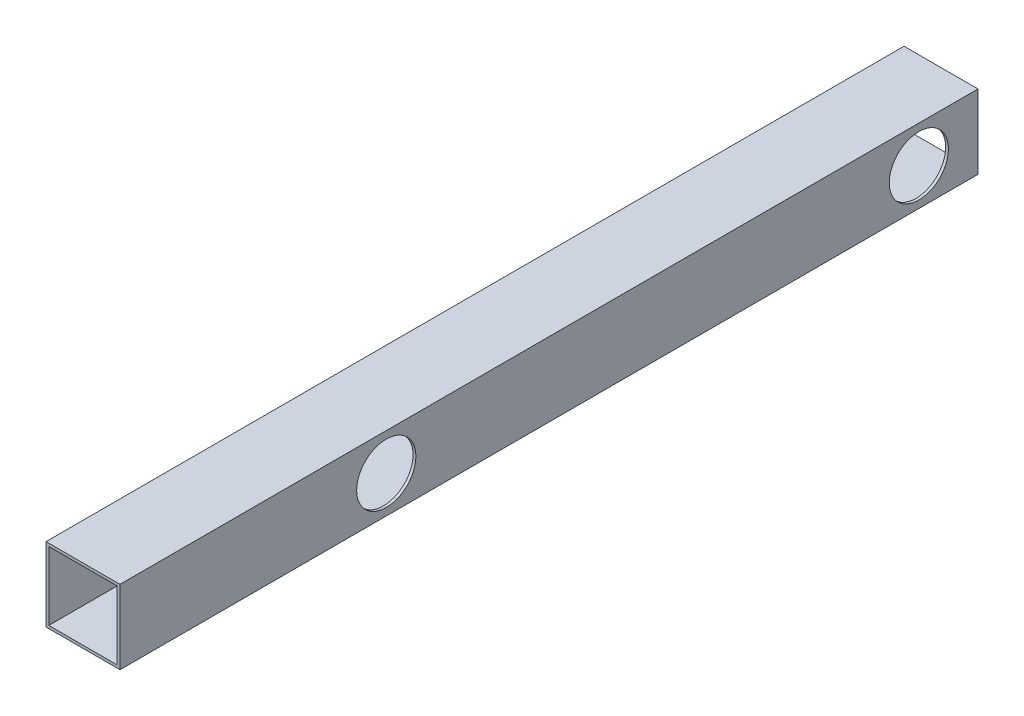
from build123d import *

# Parameters (mm, degrees)
BOSS_EXTRUDE1_DEPTH      = 431.8
BOSS_EXTRUDE1_DEPTH_BACK = 304.8
SKETCH1_W                = 63.5
SKETCH1_H                = 63.5
SKETCH1_W_2              = 58.7375
SKETCH1_H_2              = 58.7375
SKETCH2_R                = 25.4
CUT_EXTRUDE1_DEPTH       = 438.597477712


with BuildPart() as part:
    # Sketch1 → Boss-Extrude1 (new, two sides: drawn at the far end of the back side and taken through both)
    with BuildSketch(Plane.XY.offset(-BOSS_EXTRUDE1_DEPTH_BACK)):
        Rectangle(SKETCH1_W, SKETCH1_H)
        Rectangle(SKETCH1_W_2, SKETCH1_H_2, mode=Mode.SUBTRACT)
    extrude(amount=BOSS_EXTRUDE1_DEPTH + BOSS_EXTRUDE1_DEPTH_BACK)

    # Sketch2 → Cut-Extrude1 (cut, through all)
    with BuildSketch(Plane.ZY.offset(31.75)):
        with Locations((-254, 0)):
            Circle(SKETCH2_R)
        with Locations((203.2, 0)):
            Circle(SKETCH2_R)
    extrude(amount=-CUT_EXTRUDE1_DEPTH, mode=Mode.SUBTRACT)


solid = part.part
